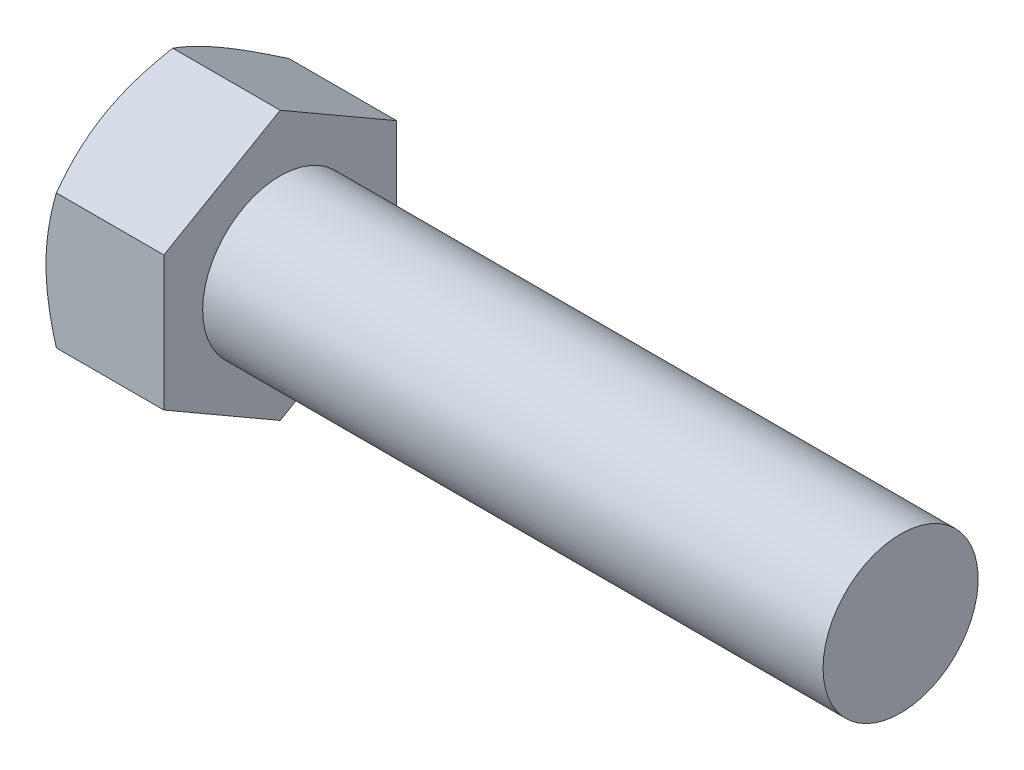
from build123d import *

# Parameters (mm, degrees)
SKETCH2_R     = 5.554416859
HEX_DIE_DEPTH = 4.826
SKETCH4_R     = 4.1671875
INDENT_DEPTH  = 0.60325


with BuildPart() as part:
    # BodySke → Base-Revolve (revolve)
    with BuildSketch(Plane.XY, mode=Mode.PRIVATE) as base_revolve_sk:
        Polygon((4.826, 3.175), (4.826, 5.499422633), (0.42546248, 5.499422633), (0, 4.7625), (0, 0), (30.226, 0), (30.226, 3.175), align=None)
    revolve(base_revolve_sk.sketch.rotate(Axis((-25.4, 0, 0), (1, 0, 0)), 90), axis=Axis((-25.4, 0, 0), (1, 0, 0)))

    # Sketch2 → Hex-Die (cut)
    with BuildSketch(Plane(origin=(0, 0, 0), x_dir=(0, 0, -1), z_dir=(1, 0, 0))):
        Circle(SKETCH2_R)
        Polygon((-4.7625, 2.749630669), (0, 5.499261338), (4.7625, 2.749630669), (4.7625, -2.749630669), (0, -5.499261338), (-4.7625, -2.749630669), align=None, mode=Mode.SUBTRACT)
    extrude(amount=HEX_DIE_DEPTH, mode=Mode.SUBTRACT)

    # Sketch4 → Indent (cut)
    with BuildSketch(Plane(origin=(0, 0, 0), x_dir=(0, 0, -1), z_dir=(1, 0, 0))):
        Circle(SKETCH4_R)
    extrude(amount=INDENT_DEPTH, mode=Mode.SUBTRACT)


solid = part.part
